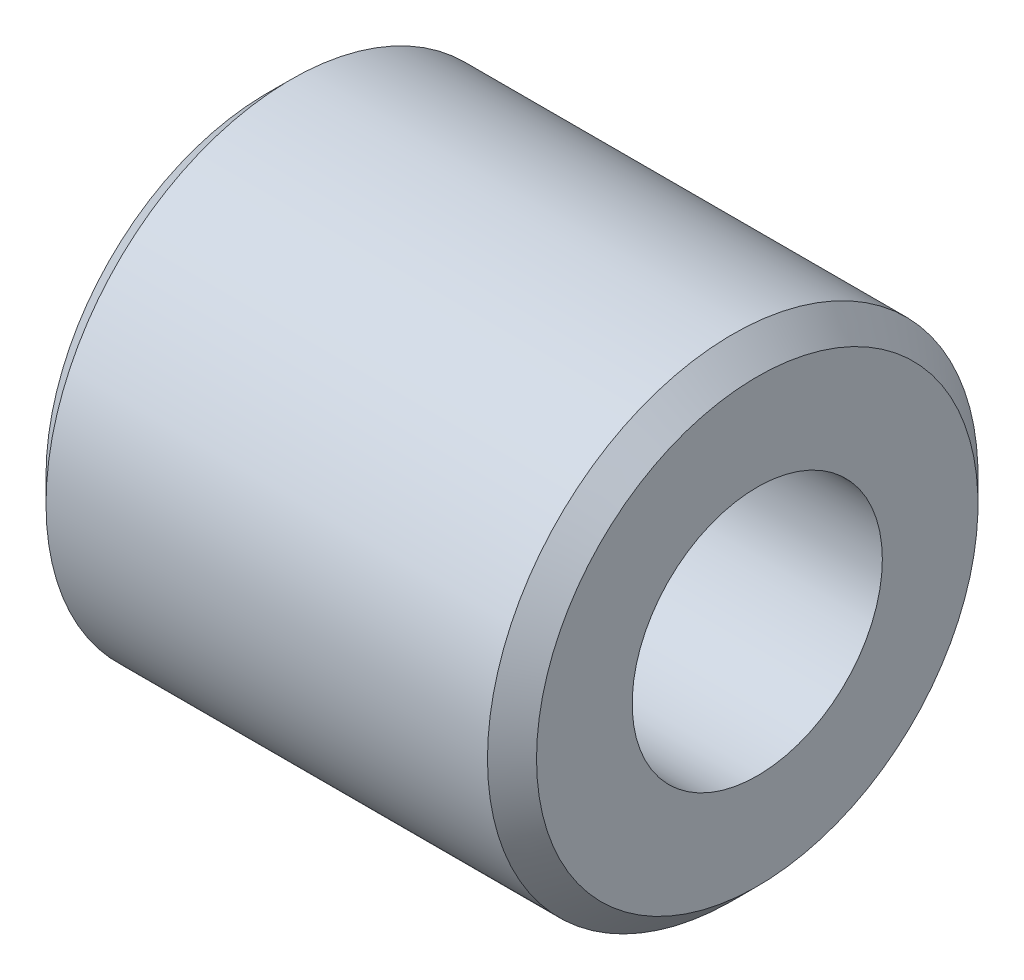
from build123d import *

# Parameters (mm, degrees)
TROU_TARAUD_M12X1_751_D = 10.2


with BuildPart() as part:
    # Esquisse1 → Base-Révolution (revolve)
    with BuildSketch(Plane.XY, mode=Mode.PRIVATE) as base_r_volution_sk:
        Polygon((0, 0), (-20, 0), (-20, 9), (-19, 10), (-1, 10), (0, 9), align=None)
    revolve(base_r_volution_sk.sketch.rotate(Axis((-22.039051672, 0, 0), (1, 0, 0)), 90), axis=Axis((-22.039051672, 0, 0), (1, 0, 0)))

    # Trou taraudé M12x1.751 (through all)
    with Locations(Plane(origin=(0, 0, 0), x_dir=(0, 0, -1), z_dir=(1, 0, 0))):
        with Locations((0, 0)):
            Hole(TROU_TARAUD_M12X1_751_D / 2)


solid = part.part
